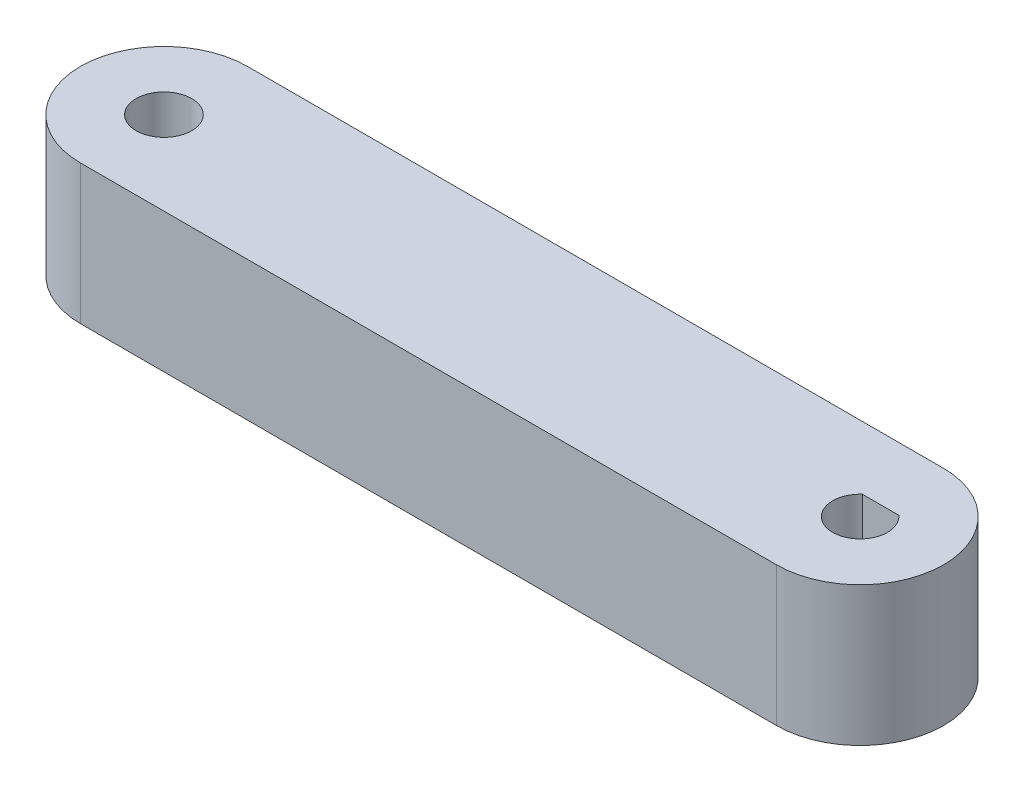
from build123d import *

# Parameters (mm, degrees)
BOSS_EXTRUDE1_DEPTH = 12.7
SKETCH4_R           = 2.54
CUT_EXTRUDE3_DEPTH  = 43.063657711
CUT_EXTRUDE4_DEPTH  = 43.063657711


with BuildPart() as part:
    # Sketch3 → Boss-Extrude1 (new body)
    with BuildSketch(Plane(origin=(0, 0, 0), x_dir=(1, 0, 0), z_dir=(0, 1, 0))):
        with BuildLine():
            Line((-31.75, 7.62), (31.75, 7.62))
            ThreePointArc((31.75, 7.62), (39.37, 0), (31.75, -7.62))
            Line((31.75, -7.62), (-31.75, -7.62))
            ThreePointArc((-31.75, -7.62), (-39.37, 0), (-31.75, 7.62))
        make_face()
    extrude(amount=BOSS_EXTRUDE1_DEPTH)

    # Sketch4 → Cut-Extrude3 (cut, through all)
    with BuildSketch(Plane(origin=(0, 12.7, 0), x_dir=(1, 0, 0), z_dir=(0, 1, 0))):
        with Locations(Location((-31.75, 0, 0), (0, 0, 270))):
            Circle(SKETCH4_R)
    extrude(amount=-CUT_EXTRUDE3_DEPTH, mode=Mode.SUBTRACT)

    # Sketch6 → Cut-Extrude4 (cut, through all)
    with BuildSketch(Plane(origin=(0, 12.7, 0), x_dir=(1, 0, 0), z_dir=(0, 1, 0))):
        with BuildLine():
            Line((33.40881749, 1.870380853), (30.09118251, 1.870380853))
            ThreePointArc((30.09118251, 1.870380853), (30.72458392, -2.280026724), (34.25, 0))
            ThreePointArc((34.25, 0), (34.030026724, 1.02541608), (33.40881749, 1.870380853))
        make_face()
    extrude(amount=-CUT_EXTRUDE4_DEPTH, mode=Mode.SUBTRACT)


solid = part.part
